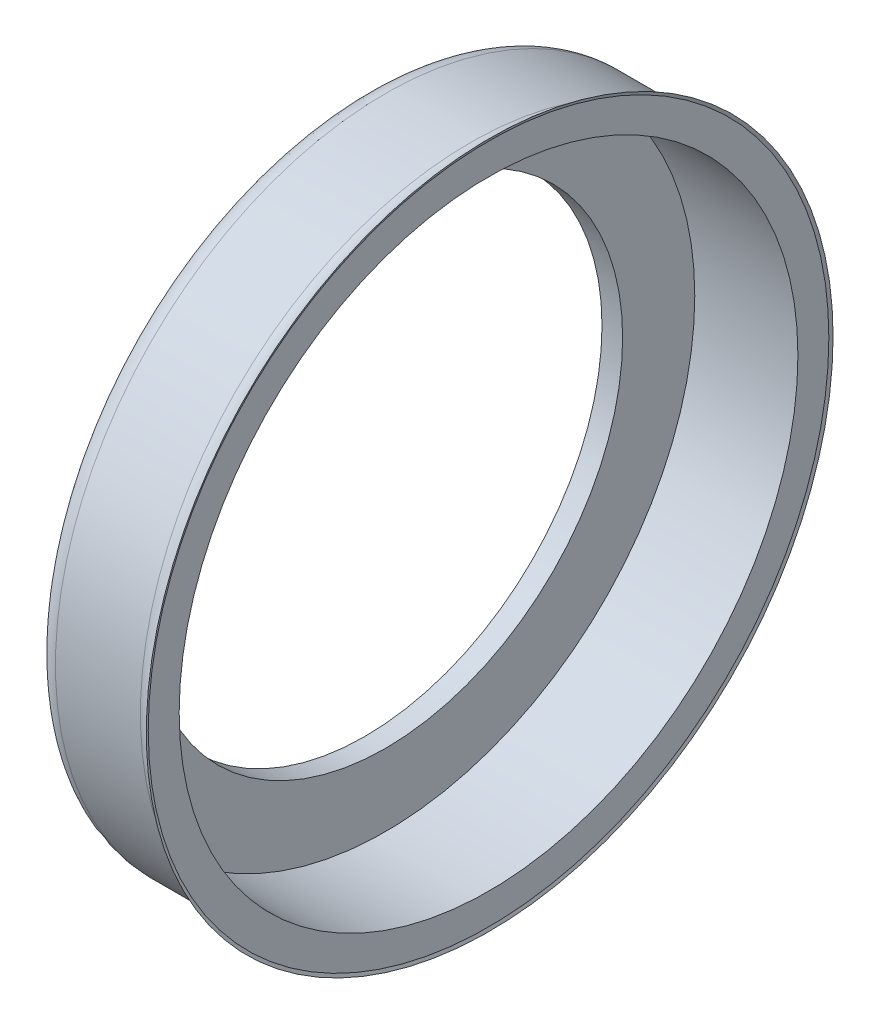
from build123d import *


with BuildPart() as part:
    # Croquis1 → Revolución1 (revolve)
    with BuildSketch(Plane(origin=(0, 0, 0), x_dir=(1, 0, 0), z_dir=(0, 1, 0))):
        with BuildLine():
            Line((-0.88053939, 16), (-5, 16))
            ThreePointArc((-5, 16), (-5.707106781, 15.707106781), (-6, 15))
            Line((-6, 15), (-6, 11.50146596))
            Line((-6, 11.50146596), (-5, 11.50146596))
            Line((-5, 11.50146596), (-5, 15))
            Line((-5, 15), (0, 15))
            Line((0, 15), (0, 16.5))
            Line((0, 16.5), (0.055870191, 16.649091044))
            ThreePointArc((0.055870191, 16.649091044), (-0.310850421, 16.178139624), (-0.88053939, 16))
        make_face()
    revolve(axis=Axis((0, 0, 0), (-1, 0, 0)))


solid = part.part
